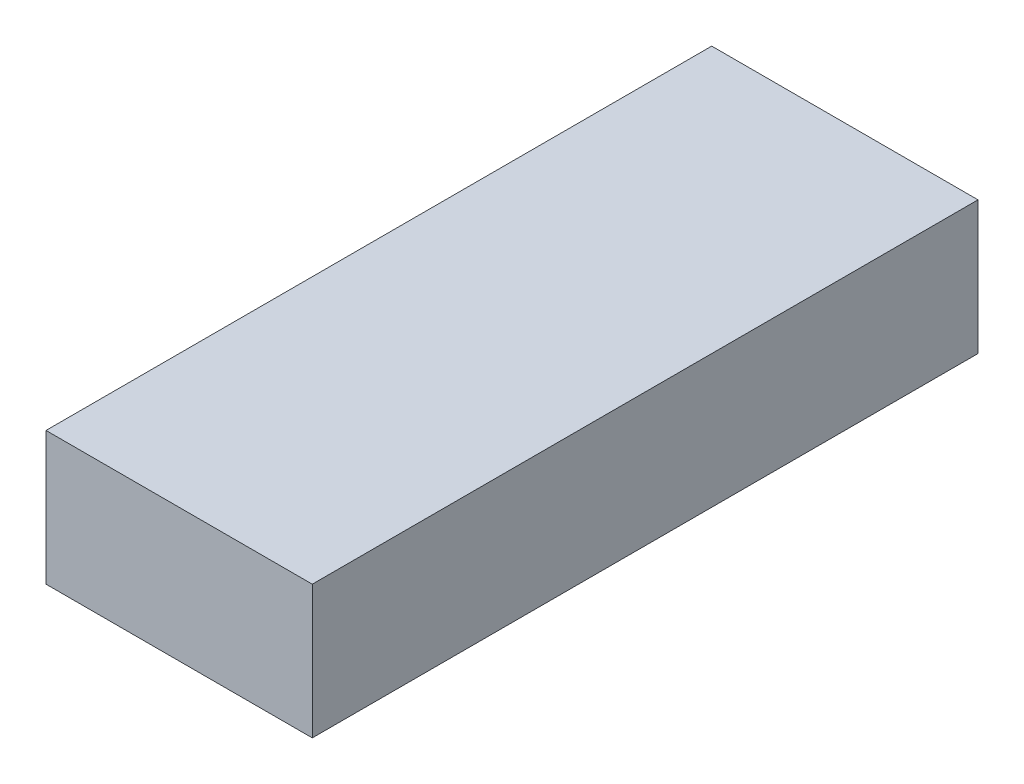
from build123d import *

# Parameters (mm, degrees)
SKETCH1_W           = 6.35
SKETCH1_H           = 15.875
BOSS_EXTRUDE1_DEPTH = 3.175


with BuildPart() as part:
    # Sketch1 → Boss-Extrude1 (new body)
    with BuildSketch(Plane(origin=(0, 0, 0), x_dir=(1, 0, 0), z_dir=(0, 1, 0))):
        with Locations((3.175, 7.9375)):
            Rectangle(SKETCH1_W, SKETCH1_H)
    extrude(amount=BOSS_EXTRUDE1_DEPTH)


solid = part.part
